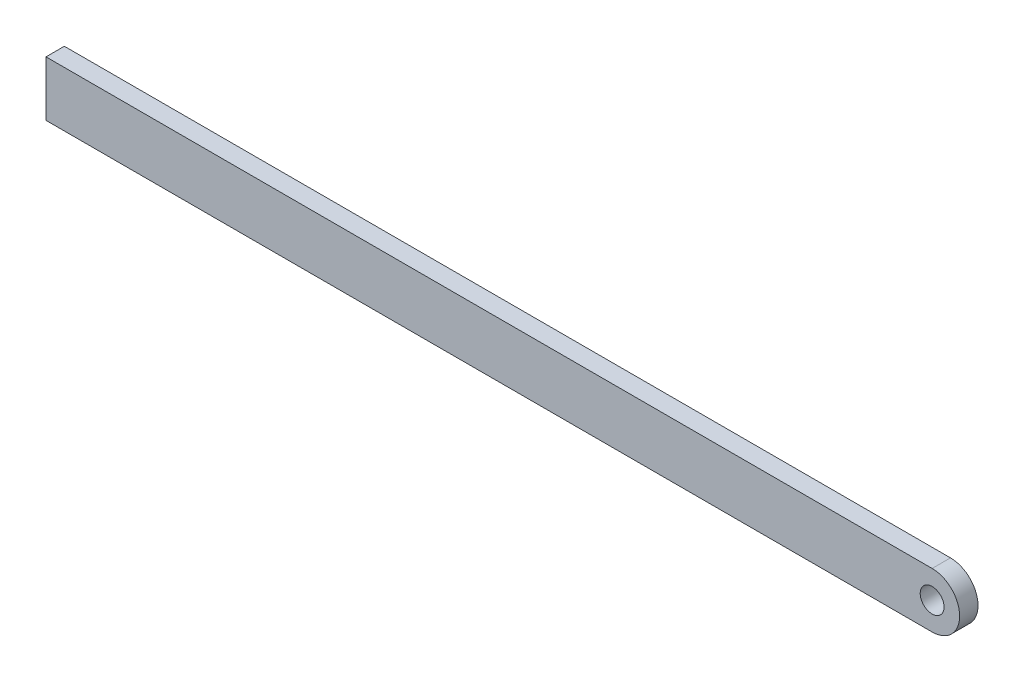
from build123d import *

# Parameters (mm, degrees)
SKETCH1_R           = 3.25
BOSS_EXTRUDE1_DEPTH = 2.5


with BuildPart() as part:
    # Sketch1 → Boss-Extrude1 (new, symmetric)
    with BuildSketch(Plane.XY):
        with BuildLine():
            Line((0, 7.5), (241.46, 7.5))
            ThreePointArc((241.46, 7.5), (248.96, 0), (241.46, -7.5))
            Line((241.46, -7.5), (0, -7.5))
            Line((0, -7.5), (0, 7.5))
        make_face()
        with Locations((241.46, 0)):
            Circle(SKETCH1_R, mode=Mode.SUBTRACT)
    extrude(amount=BOSS_EXTRUDE1_DEPTH, both=True)


solid = part.part
